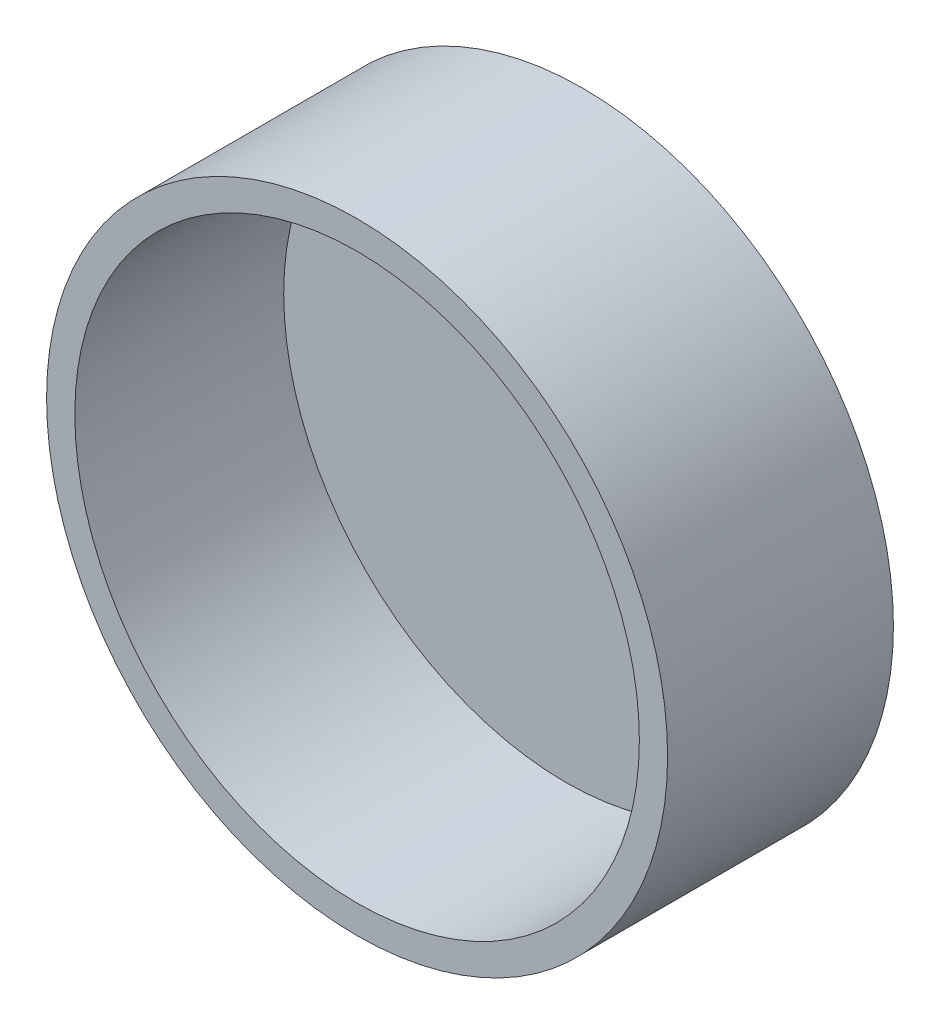
from build123d import *

# Parameters (mm, degrees)
SKETCH1_R           = 100
SKETCH1_R_2         = 14
BOSS_EXTRUDE1_DEPTH = 6
SKETCH1_3_R         = 110
SKETCH1_3_R_2       = 100
BOSS_EXTRUDE2_DEPTH = 80
BOSS_EXTRUDE3_START = -5
SKETCH1_10_R        = 17
SKETCH1_10_R_2      = 10.75
SKETCH1_10_R_3      = 10
SKETCH1_10_R_4      = 3
BOSS_EXTRUDE3_DEPTH = 5


with BuildPart() as part:
    # Sketch1 → Boss-Extrude1 (new body)
    with BuildSketch(Plane.XY):
        Circle(SKETCH1_R)
        with Locations((0, 65)):
            Circle(SKETCH1_R_2, mode=Mode.SUBTRACT)
        with BuildLine():
            ThreePointArc((-47.821809018, 65), (-41.121809018, 71.7), (-34.421809018, 65))
            ThreePointArc((-34.421809018, 65), (-41.121809018, 58.3), (-47.821809018, 65))
        make_face(mode=Mode.SUBTRACT)
        with BuildLine():
            ThreePointArc((48.021809018, 65), (41.121809018, 58.1), (34.221809018, 65))
            ThreePointArc((34.221809018, 65), (41.121809018, 71.9), (48.021809018, 65))
        make_face(mode=Mode.SUBTRACT)
    extrude(amount=BOSS_EXTRUDE1_DEPTH)

    # Sketch1<3> → Boss-Extrude2 (add)
    with BuildSketch(Plane.XY):
        Circle(SKETCH1_3_R)
        Circle(SKETCH1_3_R_2, mode=Mode.SUBTRACT)
    extrude(amount=BOSS_EXTRUDE2_DEPTH)

    # Sketch1<10> → Boss-Extrude3 (add)
    # profile 1 of 3: a face of its own
    with BuildSketch(Plane.XY.offset(BOSS_EXTRUDE3_START)):
        with Locations((0, 65)):
            Circle(SKETCH1_10_R)
        with Locations((0, 65)):
            Circle(SKETCH1_10_R_2, mode=Mode.SUBTRACT)
    # profile 2 of 3: a face of its own
    with BuildSketch(Plane.XY.offset(BOSS_EXTRUDE3_START)):
        with Locations((41.121809018, 65)):
            Circle(SKETCH1_10_R_3)
        with BuildLine():
            ThreePointArc((48.021809018, 65), (41.121809018, 58.1), (34.221809018, 65))
            ThreePointArc((34.221809018, 65), (41.121809018, 71.9), (48.021809018, 65))
        make_face(mode=Mode.SUBTRACT)
    # profile 3 of 3: a face of its own
    with BuildSketch(Plane.XY.offset(BOSS_EXTRUDE3_START)):
        with Locations((-41.121809018, 65)):
            Circle(SKETCH1_10_R_3)
        with Locations((-41.121809018, 65)):
            Circle(SKETCH1_10_R_4, mode=Mode.SUBTRACT)
    extrude(amount=BOSS_EXTRUDE3_DEPTH)


solid = part.part
